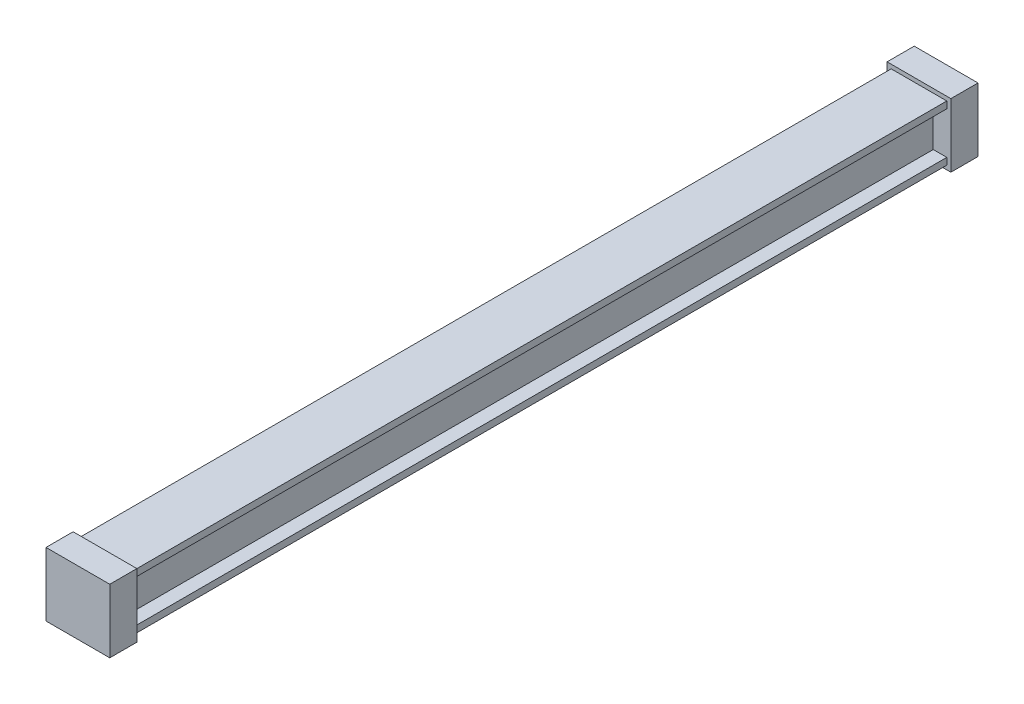
from build123d import *

# Parameters (mm, degrees)
SKETCH1_W           = 41
SKETCH1_H           = 41
BOSS_EXTRUDE1_DEPTH = 640
SKETCH2_W           = 47
SKETCH2_H           = 47
BOSS_EXTRUDE2_DEPTH = 20
SKETCH3_W           = 600
SKETCH3_H           = 31
CUT_EXTRUDE1_DEPTH  = 10


with BuildPart() as part:
    # Sketch1 → Boss-Extrude1 (new body)
    with BuildSketch(Plane.XY):
        Rectangle(SKETCH1_W, SKETCH1_H)
    extrude(amount=BOSS_EXTRUDE1_DEPTH)

    # Sketch2 → Boss-Extrude2 (add)
    with BuildSketch(Plane(origin=(0, 0, 0), x_dir=(-1, 0, 0), z_dir=(0, 0, -1))):
        Rectangle(SKETCH2_W, SKETCH2_H)
    boss_extrude2 = extrude(amount=-BOSS_EXTRUDE2_DEPTH)

    # Mirror1: Boss-Extrude2 across plane
    add(boss_extrude2.mirror(Plane(origin=(0, 0, 320), x_dir=(1, 0, 0), z_dir=(0, 0, -1))))

    # Sketch3 → Cut-Extrude1 (cut)
    with BuildSketch(Plane(origin=(20.5, 0, 0), x_dir=(0, 0, -1), z_dir=(1, 0, 0))):
        with Locations((-320, 0)):
            Rectangle(SKETCH3_W, SKETCH3_H)
    extrude(amount=-CUT_EXTRUDE1_DEPTH, mode=Mode.SUBTRACT)


solid = part.part
